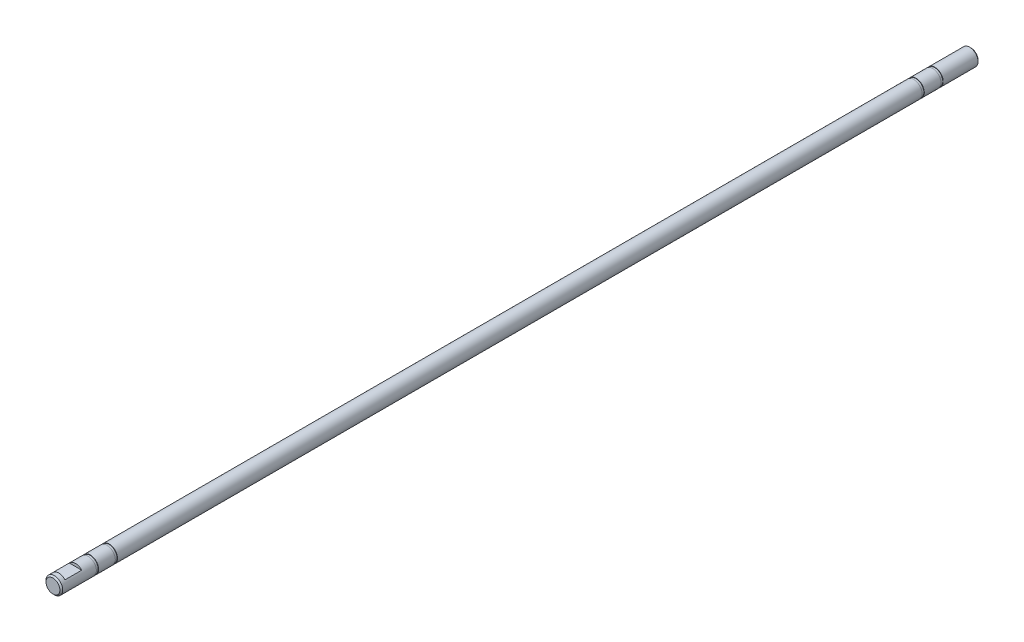
from build123d import *

# Parameters (mm, degrees)
SKETCH1_R           = 3
BOSS_EXTRUDE1_DEPTH = 330
CUT_EXTRUDE1_START  = -13
SKETCH2_R           = 3
SKETCH2_R_2         = 2.85
CUT_EXTRUDE1_DEPTH  = 0.8
CUT_EXTRUDE2_START  = -6
SKETCH3_R           = 3
SKETCH3_R_2         = 2.85
CUT_EXTRUDE2_DEPTH  = 0.8
CUT_EXTRUDE3_START  = -296
SKETCH3_2_R         = 3
SKETCH3_2_R_2       = 2.85
CUT_EXTRUDE3_DEPTH  = 0.8
CUT_EXTRUDE4_START  = -302.8
SKETCH3_3_R         = 3
SKETCH3_3_R_2       = 2.85
CUT_EXTRUDE4_DEPTH  = 0.8
CUT_EXTRUDE5_START  = 3
SKETCH4_W           = 6
SKETCH4_H           = 6
CUT_EXTRUDE5_DEPTH  = 1
CHAMFER1_SIZE       = 0.5


with BuildPart() as part:
    # Sketch1 → Boss-Extrude1 (new body)
    with BuildSketch(Plane.XY):
        Circle(SKETCH1_R)
    extrude(amount=BOSS_EXTRUDE1_DEPTH)

    # Sketch2 → Cut-Extrude1 (cut)
    with BuildSketch(Plane(origin=(0, 0, 0), x_dir=(-1, 0, 0), z_dir=(0, 0, -1)).offset(CUT_EXTRUDE1_START)):
        Circle(SKETCH2_R)
        Circle(SKETCH2_R_2, mode=Mode.SUBTRACT)
    extrude(amount=-CUT_EXTRUDE1_DEPTH, mode=Mode.SUBTRACT)

    # Sketch3 → Cut-Extrude2 (cut)
    with BuildSketch(Plane(origin=(0, 0, 13.8), x_dir=(-1, 0, 0), z_dir=(0, 0, -1)).offset(CUT_EXTRUDE2_START)):
        Circle(SKETCH3_R)
        Circle(SKETCH3_R_2, mode=Mode.SUBTRACT)
    extrude(amount=-CUT_EXTRUDE2_DEPTH, mode=Mode.SUBTRACT)

    # Sketch3<2> → Cut-Extrude3 (cut)
    with BuildSketch(Plane(origin=(0, 0, 13.8), x_dir=(-1, 0, 0), z_dir=(0, 0, -1)).offset(CUT_EXTRUDE3_START)):
        Circle(SKETCH3_2_R)
        Circle(SKETCH3_2_R_2, mode=Mode.SUBTRACT)
    extrude(amount=-CUT_EXTRUDE3_DEPTH, mode=Mode.SUBTRACT)

    # Sketch3<3> → Cut-Extrude4 (cut)
    with BuildSketch(Plane(origin=(0, 0, 13.8), x_dir=(-1, 0, 0), z_dir=(0, 0, -1)).offset(CUT_EXTRUDE4_START)):
        Circle(SKETCH3_3_R)
        Circle(SKETCH3_3_R_2, mode=Mode.SUBTRACT)
    extrude(amount=-CUT_EXTRUDE4_DEPTH, mode=Mode.SUBTRACT)

    # Sketch4 → Cut-Extrude5 (cut)
    with BuildSketch(Plane(origin=(0, 0, 0), x_dir=(1, 0, 0), z_dir=(0, 1, 0)).offset(CUT_EXTRUDE5_START)):
        with Locations((0, -324.9)):
            Rectangle(SKETCH4_W, SKETCH4_H)
    extrude(amount=-CUT_EXTRUDE5_DEPTH, mode=Mode.SUBTRACT)

    # Chamfer1
    chamfer1_edges = [part.edges().sort_by_distance(p)[0] for p in [
        (-3, 0, 0),
        (-3, 0, 330),
    ]]
    chamfer(chamfer1_edges, length=CHAMFER1_SIZE)


solid = part.part
